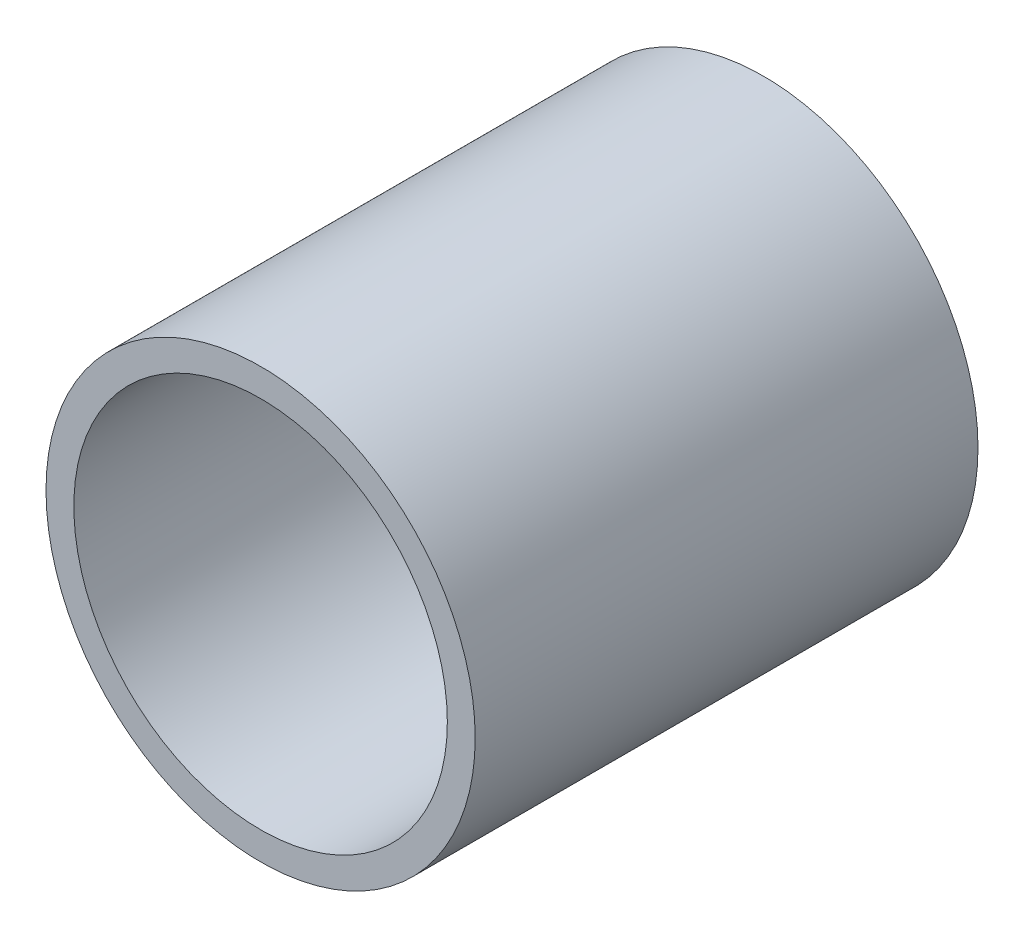
from build123d import *

# Parameters (mm, degrees)
SKETCH1_R           = 7.584
SKETCH1_R_2         = 6.6
BOSS_EXTRUDE1_DEPTH = 17.77


with BuildPart() as part:
    # Sketch1 → Boss-Extrude1 (new body)
    with BuildSketch(Plane.XY):
        Circle(SKETCH1_R)
        Circle(SKETCH1_R_2, mode=Mode.SUBTRACT)
    extrude(amount=BOSS_EXTRUDE1_DEPTH)


solid = part.part
